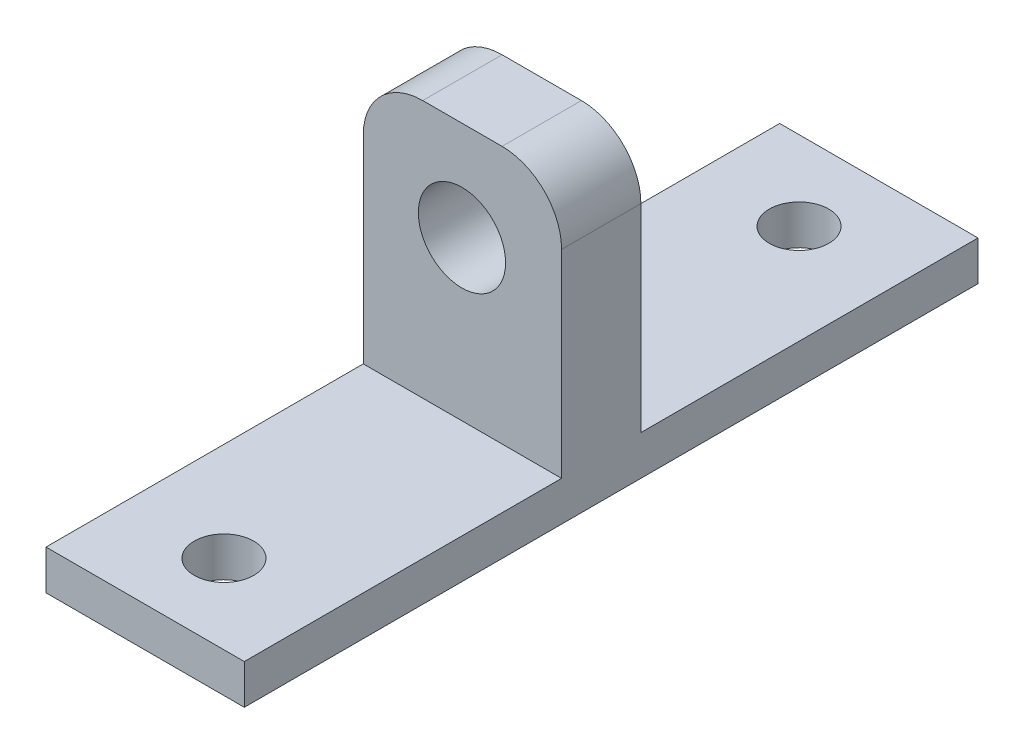
from build123d import *

# Parameters (mm, degrees)
SKETCH_1_R          = 2.2
EXTRUDE_1_DEPTH     = 4
SKETCH_2_R          = 1.5
EXTRUDE_2_DEPTH     = 2
FILLET_1_R          = 3
SKETCH_3_W          = 10
SKETCH_3_H          = 1
CUT_EXTRUDE_1_DEPTH = 10


with BuildPart() as part:
    # 草图1 → 凸台-拉伸1 (new body)
    with BuildSketch(Plane.XY):
        Polygon((-4.975166703, 0), (-4.975166703, -8), (5.024833297, -8), (5.024833297, 0), (5.024833297, 5), (-4.975166703, 5), align=None)
        Circle(SKETCH_1_R, mode=Mode.SUBTRACT)
    extrude(amount=EXTRUDE_1_DEPTH)

    # 草图2 → 凸台-拉伸2 (add)
    with BuildSketch(Plane.XZ.offset(8)):
        Polygon((5.024833297, 0), (5.024833297, -18), (-4.975166703, -18), (-4.975166703, 21), (5.024833297, 21), align=None)
        with Locations(Location((0, -13, 0), (0, 0, 270))):
            Circle(SKETCH_2_R, mode=Mode.SUBTRACT)
        with Locations(Location((0, 16, 0), (0, 0, 90))):
            Circle(SKETCH_2_R, mode=Mode.SUBTRACT)
    extrude(amount=EXTRUDE_2_DEPTH)

    # 圆角1
    fillet_1_edges = [part.edges().sort_by_distance(p)[0] for p in [
        (-4.975166703, 5, 2),
        (5.024833297, 5, 2),
    ]]
    fillet(fillet_1_edges, radius=FILLET_1_R)

    # 草图3 → 切除-拉伸1 (cut)
    with BuildSketch(Plane.XZ.offset(10)):
        with Locations((0.024833297, 20.5)):
            Rectangle(SKETCH_3_W, SKETCH_3_H)
        with Locations((0.024833297, -17.5)):
            Rectangle(SKETCH_3_W, SKETCH_3_H)
    extrude(amount=-CUT_EXTRUDE_1_DEPTH, mode=Mode.SUBTRACT)


solid = part.part
